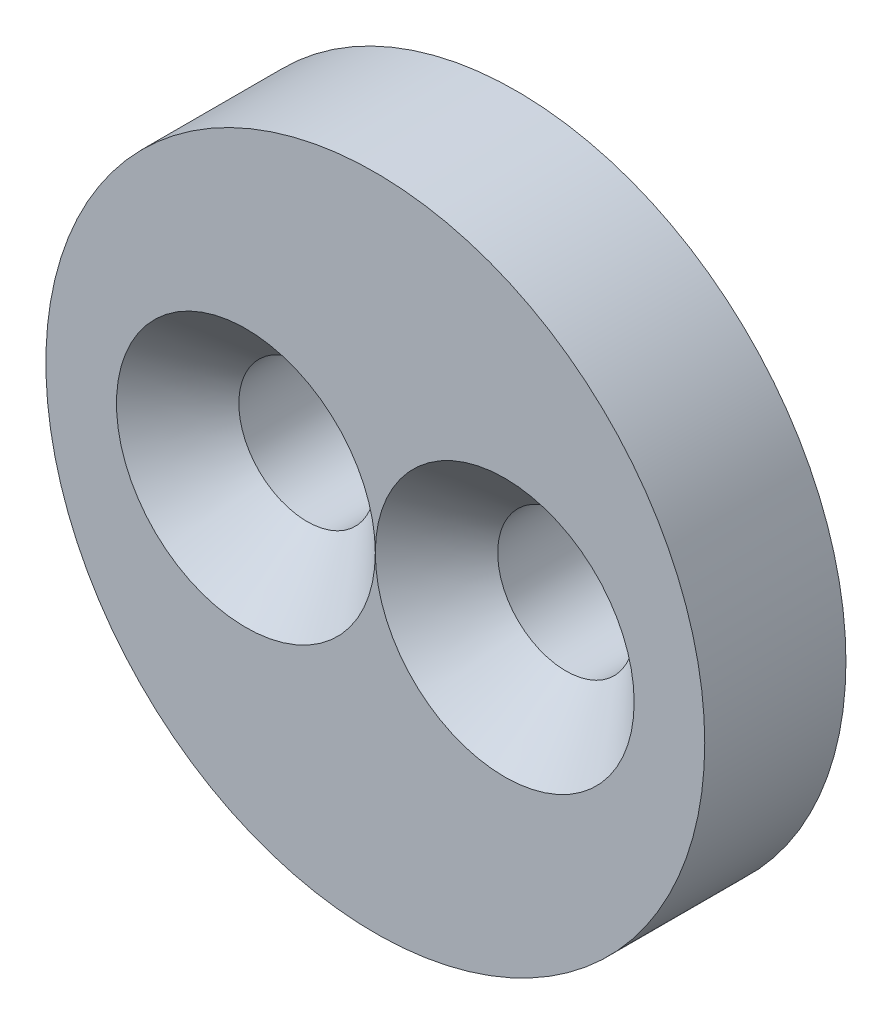
from build123d import *

# Parameters (mm, degrees)
SKETCH1_R                                            = 7
BOSS_EXTRUDE1_DEPTH                                  = 3
CSK_FOR_M2_5_COUNTERSUNK_FLAT_HEAD_SCREW_D           = 2.9
CSK_FOR_M2_5_COUNTERSUNK_FLAT_HEAD_SCREW_CSINK_D     = 5.5
CSK_FOR_M2_5_COUNTERSUNK_FLAT_HEAD_SCREW_CSINK_ANGLE = 90


with BuildPart() as part:
    # Sketch1 → Boss-Extrude1 (new body)
    with BuildSketch(Plane.XY.offset(27.3)):
        Circle(SKETCH1_R)
    extrude(amount=BOSS_EXTRUDE1_DEPTH)

    # CSK for M2.5 Countersunk Flat Head Screw1 (through all)
    with Locations(Plane.XY.offset(30.3)):
        with Locations((-2.75, 0), (2.75, 0)):
            CounterSinkHole(CSK_FOR_M2_5_COUNTERSUNK_FLAT_HEAD_SCREW_D / 2, CSK_FOR_M2_5_COUNTERSUNK_FLAT_HEAD_SCREW_CSINK_D / 2, counter_sink_angle=CSK_FOR_M2_5_COUNTERSUNK_FLAT_HEAD_SCREW_CSINK_ANGLE)


solid = part.part
